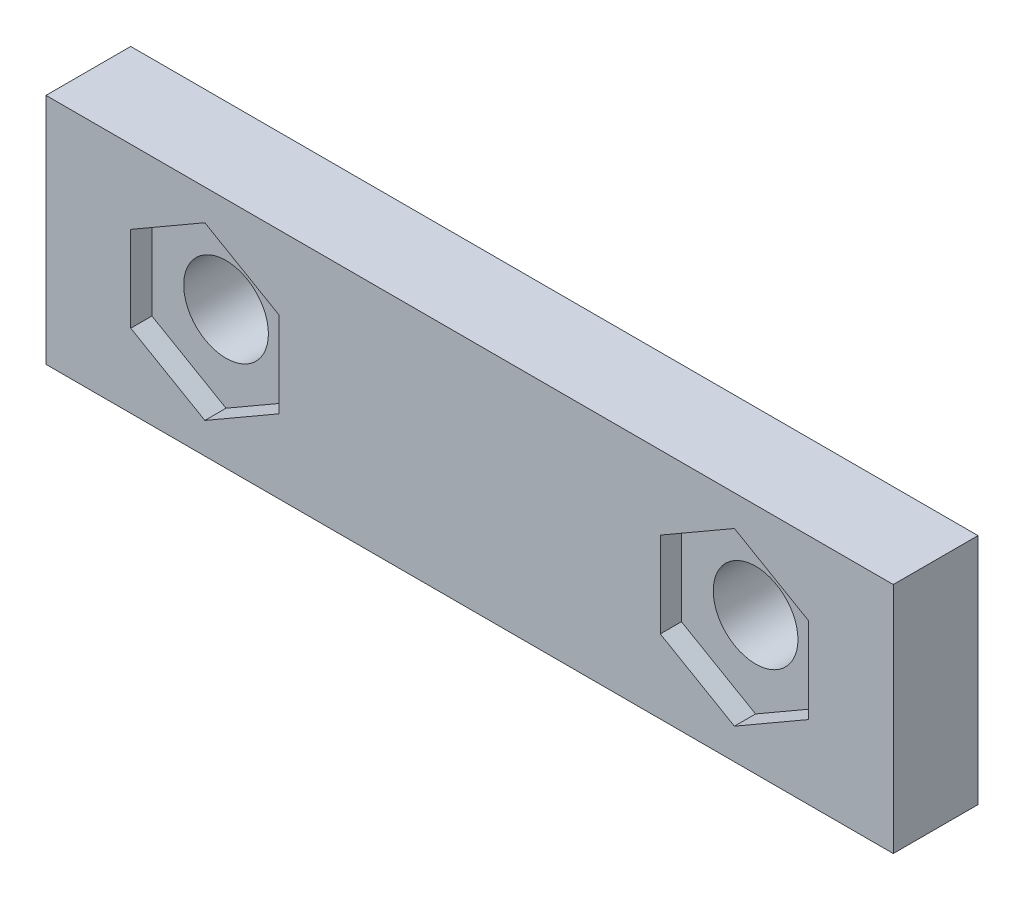
from build123d import *

# Parameters (mm, degrees)
SKETCH1_W           = 40
SKETCH1_H           = 11
SKETCH1_R           = 2
BOSS_EXTRUDE1_DEPTH = 3
SKETCH1_3_W         = 40
SKETCH1_3_H         = 11
BOSS_EXTRUDE2_DEPTH = 4


with BuildPart() as part:
    # Sketch1 → Boss-Extrude1 (new body)
    with BuildSketch(Plane.XY):
        with Locations((199.8, -45)):
            Rectangle(SKETCH1_W, SKETCH1_H)
        with Locations((187.3, -45)):
            Circle(SKETCH1_R, mode=Mode.SUBTRACT)
        with Locations((212.3, -45)):
            Circle(SKETCH1_R, mode=Mode.SUBTRACT)
    extrude(amount=BOSS_EXTRUDE1_DEPTH)

    # Sketch1<3> → Boss-Extrude2 (add)
    with BuildSketch(Plane.XY):
        with Locations((199.8, -45)):
            Rectangle(SKETCH1_3_W, SKETCH1_3_H)
        Polygon((190.8, -47.020725942), (187.3, -49.041451884), (183.8, -47.020725942), (183.8, -42.979274058), (187.3, -40.958548116), (190.8, -42.979274058), align=None, mode=Mode.SUBTRACT)
        Polygon((215.8, -47.020725942), (212.3, -49.041451884), (208.8, -47.020725942), (208.8, -42.979274058), (212.3, -40.958548116), (215.8, -42.979274058), align=None, mode=Mode.SUBTRACT)
    extrude(amount=BOSS_EXTRUDE2_DEPTH)


solid = part.part
